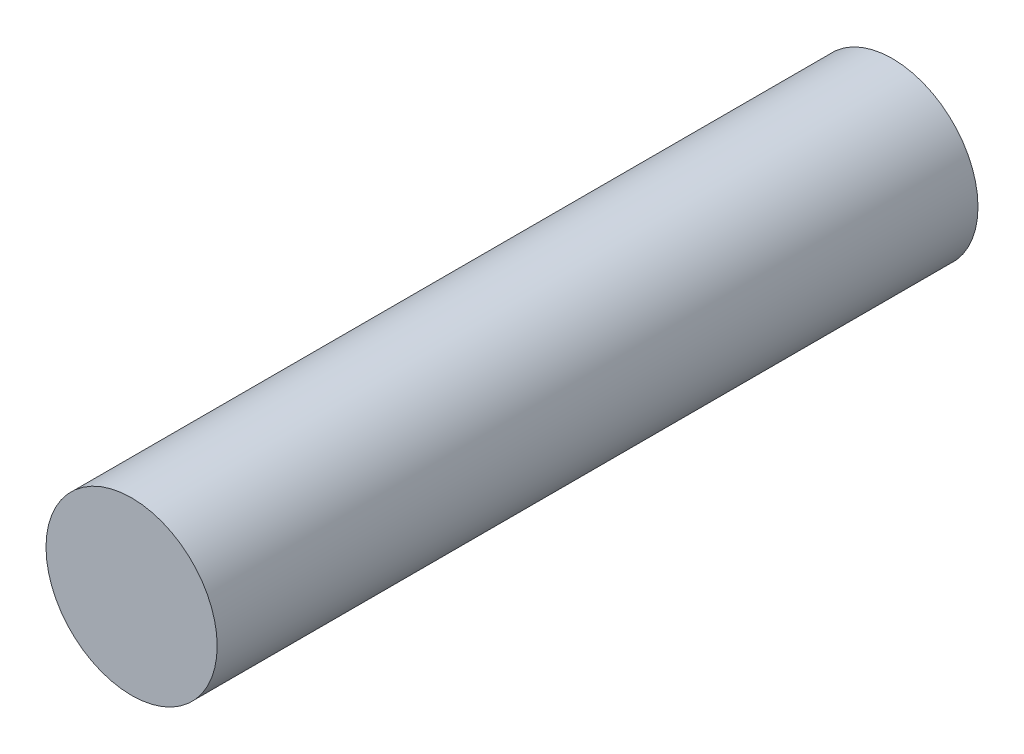
from build123d import *

# Parameters (mm, degrees)
SKETCH_1_R      = 2.25
EXTRUDE_1_DEPTH = 20


with BuildPart() as part:
    # 草圖1 → 填料-伸長1 (new body)
    with BuildSketch(Plane.XY):
        Circle(SKETCH_1_R)
    extrude(amount=EXTRUDE_1_DEPTH)


solid = part.part
